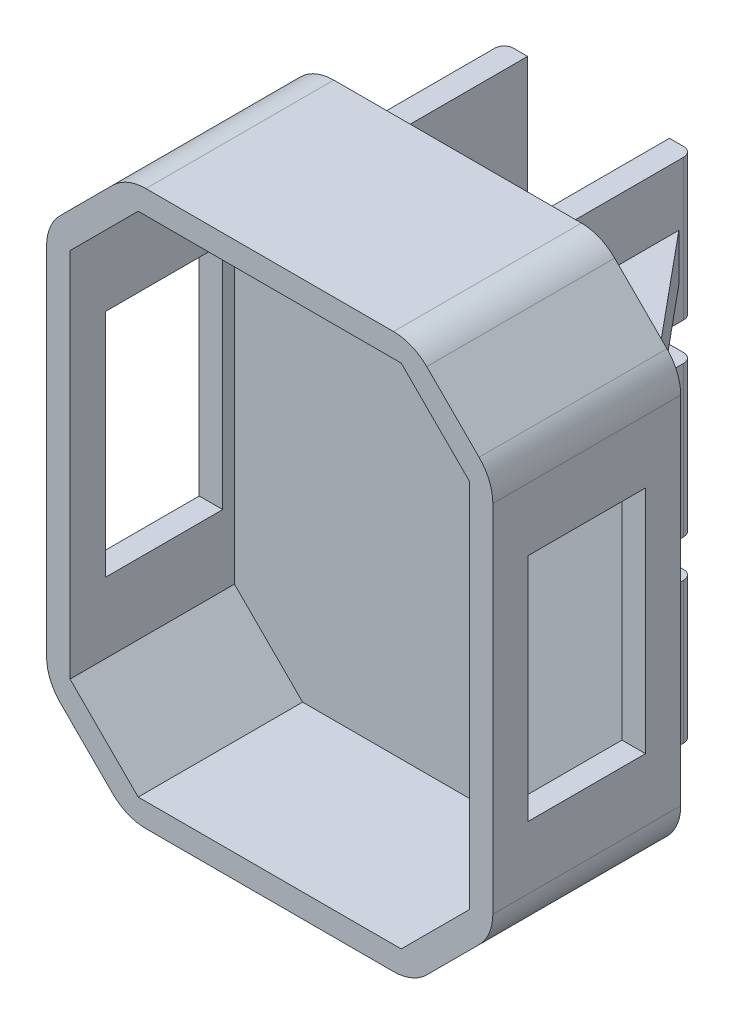
from build123d import *

# Parameters (mm, degrees)
EXTRUDE_2_DEPTH          = 35
EXTRUDE_3_DEPTH          = 5
CUT_EXTRUDE_1_DEPTH      = 84.440098274
CUT_EXTRUDE_1_DEPTH_BACK = 84.440098274
FILLET_1_R               = 10
SKETCH_3_W               = 5
SKETCH_3_H               = 108
EXTRUDE_4_DEPTH          = 35
CUT_EXTRUDE_2_DEPTH      = 84.440098274
CUT_EXTRUDE_2_DEPTH_BACK = 84.440098274
RIB_5_REACH              = 85.44
SKETCH_5_WALL_W          = 203.962385762
SKETCH_5_WALL_H          = 10
RIB_6_REACH              = 113.863
SKETCH_8_WALL_W          = 260.809051254
SKETCH_8_WALL_H          = 10
MIRROR_3_COPY_1_REACH    = 113.863
MIRROR_3_COPY_1_SKETCH_W = 260.809051254
MIRROR_3_COPY_1_SKETCH_H = 10
MIRROR_3_COPY_2_REACH    = 113.863
MIRROR_3_COPY_2_SKETCH_W = 260.809051254
MIRROR_3_COPY_2_SKETCH_H = 10
FILLET_2_R               = 2


with BuildPart() as part:
    # 스케치1 → 보스-돌출2 (new body)
    with BuildSketch(Plane.XY):
        Polygon((-47.5, 42), (-47.5, -42), (-30.5, -59), (30.5, -59), (47.5, -42), (47.5, 42), (30.5, 59), (-30.5, 59), align=None)
        Polygon((-42.5, 39.5), (-42.5, -39.5), (-28, -54), (28, -54), (42.5, -39.5), (42.5, 39.5), (28, 54), (-28, 54), align=None, mode=Mode.SUBTRACT)
    extrude(amount=EXTRUDE_2_DEPTH)

    # 스케치1<2> → 보스-돌출3 (add)
    with BuildSketch(Plane.XY):
        Polygon((-30.5, 59), (-47.5, 42), (-47.5, -42), (-30.5, -59), (30.5, -59), (47.5, -42), (47.5, 42), (30.5, 59), align=None)
    extrude(amount=-EXTRUDE_3_DEPTH)

    # 스케치2 → 컷-돌출1 (cut, two sides: drawn at the far end of the back side and taken through both)
    with BuildSketch(Plane(origin=(0, 0, 0), x_dir=(0, 0, -1), z_dir=(1, 0, 0)).offset(-CUT_EXTRUDE_1_DEPTH_BACK)):
        Polygon((-27.5, -24.5), (-7.5, -24.5), (-2.5, -24.5), (-2.5, 24.5), (-7.5, 24.5), (-27.5, 24.5), align=None)
    extrude(amount=CUT_EXTRUDE_1_DEPTH + CUT_EXTRUDE_1_DEPTH_BACK, mode=Mode.SUBTRACT)

    # 필렛1
    fillet_1_edges = [part.edges().sort_by_distance(p)[0] for p in [
        (-47.5, -42, 15),
        (-47.5, 42, 15),
        (-30.5, 59, 15),
        (30.5, 59, 15),
        (47.5, 42, 15),
        (47.5, -42, 15),
        (30.5, -59, 15),
        (-30.5, -59, 15),
    ]]
    fillet(fillet_1_edges, radius=FILLET_1_R)

    # 스케치3 → 보스-돌출4 (add)
    with BuildSketch(Plane.XY):
        with Locations((17.6, 0)):
            Rectangle(SKETCH_3_W, SKETCH_3_H)
        with Locations((-17.6, 0)):
            Rectangle(SKETCH_3_W, SKETCH_3_H)
    extrude(amount=-EXTRUDE_4_DEPTH)

    # 스케치4 → 컷-돌출2 (cut, two sides: drawn at the far end of the back side and taken through both)
    with BuildSketch(Plane(origin=(0, 0, 0), x_dir=(0, 0, -1), z_dir=(1, 0, 0)).offset(-CUT_EXTRUDE_2_DEPTH_BACK)):
        with BuildLine():
            Line((20, 16), (35, 16))
            Line((35, 16), (35, 24))
            Line((35, 24), (20, 24))
            ThreePointArc((20, 24), (16, 20), (20, 16))
        make_face()
        with BuildLine():
            Line((35, -16), (35, -24))
            Line((35, -24), (20, -24))
            ThreePointArc((20, -24), (16, -20), (20, -16))
            Line((20, -16), (35, -16))
        make_face()
    extrude(amount=CUT_EXTRUDE_2_DEPTH + CUT_EXTRUDE_2_DEPTH_BACK, mode=Mode.SUBTRACT)

    # 스케치5 wall → 보강대5 (add, up to next)
    with BuildSketch(Plane(origin=(31.3, 0, -18.5), x_dir=(-0.638500632437, 0, -0.769621298027), z_dir=(-0.769621298027, 0, 0.638500632437)), mode=Mode.PRIVATE) as rib_5_sk1:
        Rectangle(SKETCH_5_WALL_W, SKETCH_5_WALL_H)
    rib_5_tool1 = extrude(rib_5_sk1.sketch, amount=RIB_5_REACH, mode=Mode.PRIVATE) - part.part
    rib_5 = rib_5_tool1.solids().sort_by_distance((31.3, 0, -18.5))[0]
    add(rib_5)

    # 대칭 복사1: 보강대5 across plane
    add(rib_5.mirror(Plane(origin=(0, 0, 0), x_dir=(0, 0, 1), z_dir=(1, 0, 0))))

    # 스케치8 wall → 보강대6 (add, up to next)
    with BuildSketch(Plane(origin=(31.3, 36.037767227, -18.5), x_dir=(-0.638500632437, 0, -0.769621298027), z_dir=(-0.769621298027, 0, 0.638500632437)), mode=Mode.PRIVATE) as rib_6_sk1:
        Rectangle(SKETCH_8_WALL_W, SKETCH_8_WALL_H)
    rib_6_tool1 = extrude(rib_6_sk1.sketch, amount=RIB_6_REACH, mode=Mode.PRIVATE) - part.part
    rib_6 = rib_6_tool1.solids().sort_by_distance((31.3, 36.037767227, -18.5))[0]
    add(rib_6)

    # 대칭 복사2: 보강대6 across plane
    add(rib_6.mirror(Plane(origin=(0, 0, 0), x_dir=(0, 0, 1), z_dir=(1, 0, 0))))

    # 대칭 복사3 copy 1 sketch → 대칭 복사3 copy 1 (add, up to next)
    with BuildSketch(Plane(origin=(-31.3, -36.037767227, -18.5), x_dir=(0.638500632437, 0, -0.769621298027), z_dir=(0.769621298027, 0, 0.638500632437)), mode=Mode.PRIVATE) as mirror_3_copy_1_sk1:
        Rectangle(MIRROR_3_COPY_1_SKETCH_W, MIRROR_3_COPY_1_SKETCH_H)
    mirror_3_copy_1_tool1 = extrude(mirror_3_copy_1_sk1.sketch, amount=MIRROR_3_COPY_1_REACH, mode=Mode.PRIVATE) - part.part
    add(mirror_3_copy_1_tool1.solids().sort_by_distance((-31.3, -36.037767227, -18.5))[0])

    # 대칭 복사3 copy 2 sketch → 대칭 복사3 copy 2 (add, up to next)
    with BuildSketch(Plane(origin=(31.3, -36.037767227, -18.5), x_dir=(-0.638500632437, 0, -0.769621298027), z_dir=(-0.769621298027, 0, 0.638500632437)), mode=Mode.PRIVATE) as mirror_3_copy_2_sk1:
        Rectangle(MIRROR_3_COPY_2_SKETCH_W, MIRROR_3_COPY_2_SKETCH_H)
    mirror_3_copy_2_tool1 = extrude(mirror_3_copy_2_sk1.sketch, amount=MIRROR_3_COPY_2_REACH, mode=Mode.PRIVATE) - part.part
    add(mirror_3_copy_2_tool1.solids().sort_by_distance((31.3, -36.037767227, -18.5))[0])

    # 필렛2
    fillet_2_edges = [part.edges().sort_by_distance(p)[0] for p in [
        (-20.1, 39, -35),
        (-20.1, 0, -35),
        (-20.1, -39, -35),
        (20.1, 39, -35),
        (20.1, 0, -35),
        (20.1, -39, -35),
    ]]
    fillet(fillet_2_edges, radius=FILLET_2_R)


solid = part.part
